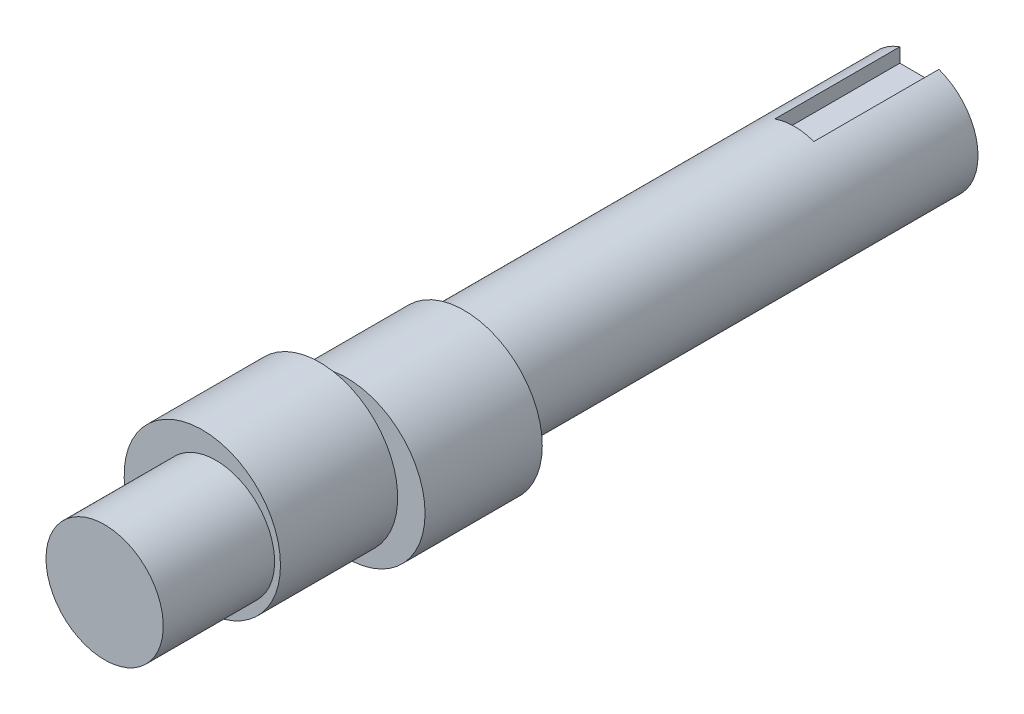
from build123d import *

# Parameters (mm, degrees)
ESQUISSE2_R             = 7.5
BOSS_EXTRU_1_DEPTH      = 60
ESQUISSE3_R             = 10
BOSS_EXTRU_2_DEPTH      = 15
ESQUISSE4_R             = 10
BOSS_EXTRU_3_DEPTH      = 15
ESQUISSE5_R             = 7.5
BOSS_EXTRU_4_DEPTH      = 14.25
ENL_V_MAT_EXTRU_1_DEPTH = 16


with BuildPart() as part:
    # Esquisse2 → Boss.-Extru.1 (new body)
    with BuildSketch(Plane.XY):
        Circle(ESQUISSE2_R)
    extrude(amount=BOSS_EXTRU_1_DEPTH)

    # Esquisse3 → Boss.-Extru.2 (add)
    with BuildSketch(Plane.XY.offset(60)):
        with Locations((1.75, 0)):
            Circle(ESQUISSE3_R)
    extrude(amount=BOSS_EXTRU_2_DEPTH)

    # Esquisse4 → Boss.-Extru.3 (add)
    with BuildSketch(Plane.XY.offset(75)):
        with Locations(Location((-1.75, 0, 0), (0, 0, 280.078658108))):
            Circle(ESQUISSE4_R)
    extrude(amount=BOSS_EXTRU_3_DEPTH)

    # Esquisse5 → Boss.-Extru.4 (add)
    with BuildSketch(Plane.XY.offset(90)):
        Circle(ESQUISSE5_R)
    extrude(amount=BOSS_EXTRU_4_DEPTH)

    # Esquisse6 → Enlèv. mat.-Extru.1 (cut)
    with BuildSketch(Plane(origin=(0, 0, 0), x_dir=(-1, 0, 0), z_dir=(0, 0, -1))):
        with BuildLine():
            Line((-2.5, 7.071067812), (-2.5, 5.25))
            Line((-2.5, 5.25), (2.5, 5.25))
            Line((2.5, 5.25), (2.5, 7.071067812))
            ThreePointArc((2.5, 7.071067812), (0, 7.5), (-2.5, 7.071067812))
        make_face()
    extrude(amount=-ENL_V_MAT_EXTRU_1_DEPTH, mode=Mode.SUBTRACT)


solid = part.part
